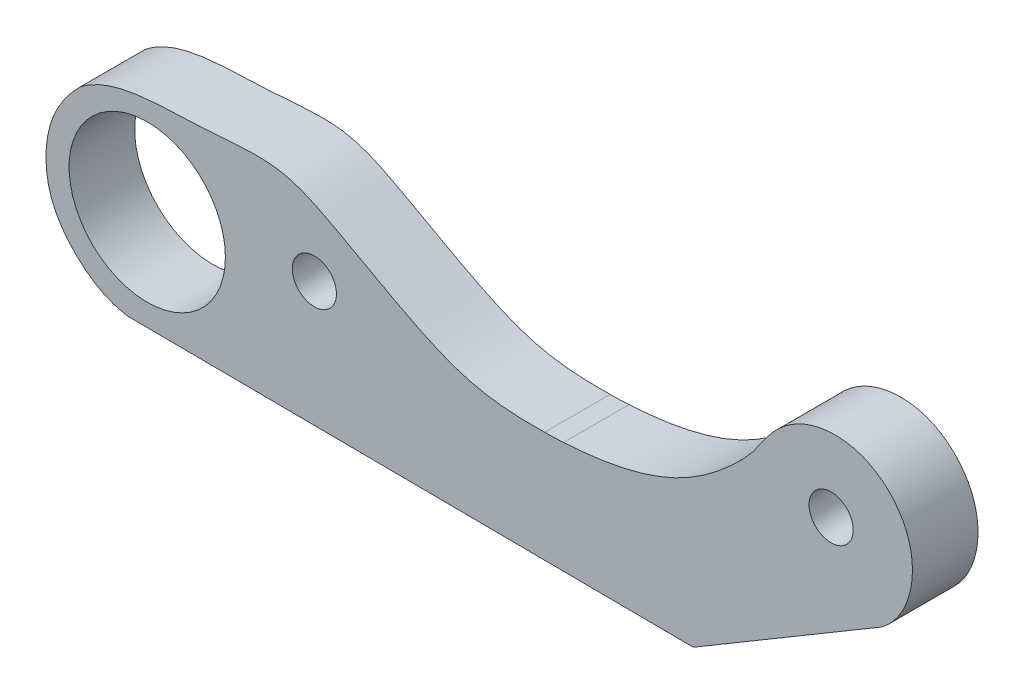
from build123d import *

# Parameters (mm, degrees)
SCHIZZO2_R                   = 6.02
SCHIZZO2_R_2                 = 1.7
ESTRUSIONE_ESTRUSIONE1_DEPTH = 5.05


with BuildPart() as part:
    # Schizzo2 → Estrusione-Estrusione1 (new body)
    with BuildSketch(Plane.XY):
        with BuildLine():
            Line((-89.374898214, 10.44391596), (-45.806517375, 10.138527109))
            Line((-45.806517375, 10.138527109), (-31.279343931, 18.753125585))
            add(Edge.make_bspline(
                [(-31.279343931, 18.753125585), (-29.098043345, 20.403651058), (-27.905057256, 25.441624833), (-32.300384053, 29.85841163), (-36.690541673, 29.918863446), (-39.614892883, 27.942376602), (-41.03245157, 25.552100431), (-43.284640457, 23.241638673), (-47.763557065, 19.862154048), (-52.57074608, 18.979169365), (-55.803154975, 18.8049533)],
                knots=[0, 0, 0, 0, 0.102244465, 0.160154236, 0.214292787, 0.256272844, 0.289149591, 0.319658417, 0.379342086, 0.500706378, 0.500706378, 0.500706378, 0.500706378], degree=3))
            add(Edge.make_bspline(
                [(-57.25626525, 18.753125585), (-56.52869344, 18.753125585), (-55.803154975, 18.8049533)],
                knots=[4.71238898, 4.71238898, 4.71238898, 4.787168695, 4.787168695, 4.787168695], degree=2, weights=[1, 0.999301081, 1]))
            add(Edge.make_bspline(
                [(-57.25626525, 18.753125585), (-59.155150134, 18.717879159), (-63.127762505, 18.895973961), (-68.30110331, 21.45743798), (-72.985617709, 24.08656858), (-76.315266746, 25.875128424), (-79.739526403, 26.236715977), (-83.278928702, 25.795001813), (-88.238817678, 25.8484339), (-91.689171987, 24.998953947), (-93.083744843, 23.851210505)],
                knots=[0.518902231, 0.518902231, 0.518902231, 0.518902231, 0.590344576, 0.669858142, 0.735080639, 0.798411316, 0.810363017, 0.866325434, 0.934003559, 1, 1, 1, 1], degree=3))
            add(Edge.make_bspline(
                [(-93.083744843, 23.851210505), (-93.963586918, 22.989018523), (-95.239548576, 21.18289576), (-95.824246169, 18.047120823), (-95.406173905, 15.162358675), (-93.315245164, 12.148204862), (-91.089335339, 10.692555949), (-89.374898214, 10.44391596)],
                knots=[0.80240839, 0.80240839, 0.80240839, 0.80240839, 0.844688232, 0.876032892, 0.910905343, 0.942275004, 1, 1, 1, 1], degree=3))
        make_face()
        with Locations((-87.866678473, 18.139302594)):
            Circle(SCHIZZO2_R, mode=Mode.SUBTRACT)
        with Locations((-74.993560801, 19.956508848)):
            Circle(SCHIZZO2_R_2, mode=Mode.SUBTRACT)
        with Locations((-35.18906777, 24.113568479)):
            Circle(SCHIZZO2_R_2, mode=Mode.SUBTRACT)
    extrude(amount=ESTRUSIONE_ESTRUSIONE1_DEPTH)


solid = part.part
